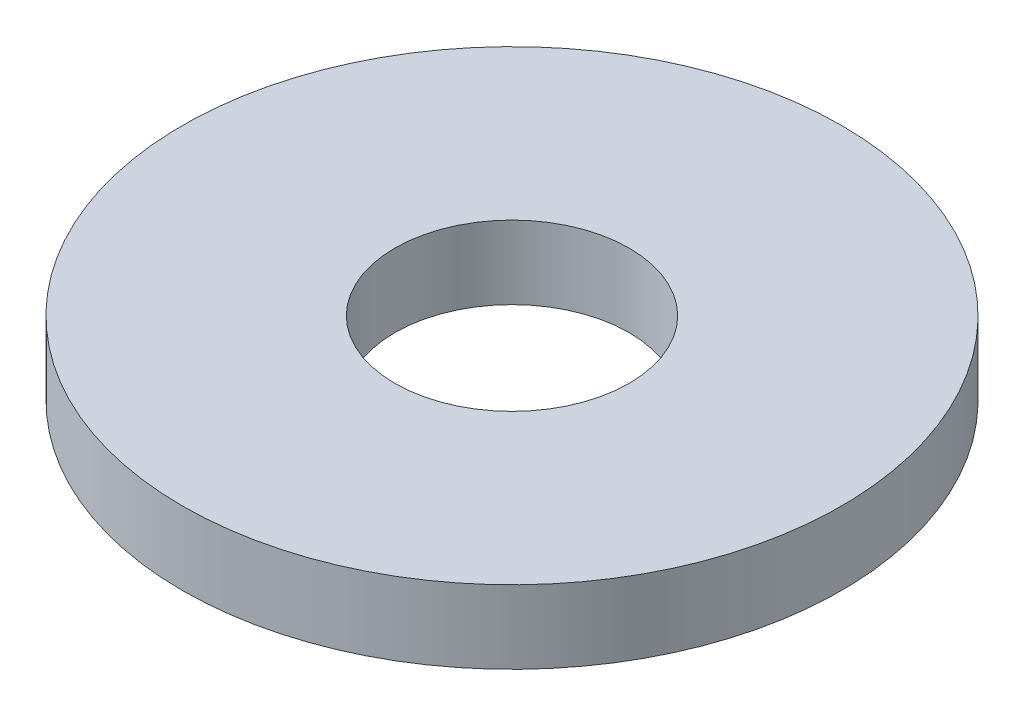
from build123d import *

# Parameters (mm, degrees)
SKETCH1_R           = 4.5
SKETCH1_R_2         = 1.6
BOSS_EXTRUDE1_DEPTH = 1


with BuildPart() as part:
    # Sketch1 → Boss-Extrude1 (new body)
    with BuildSketch(Plane(origin=(0, 0, 0), x_dir=(1, 0, 0), z_dir=(0, 1, 0))):
        with Locations(Location((0, 0, 0), (0, 0, 270))):
            Circle(SKETCH1_R)
        with Locations(Location((0, 0, 0), (0, 0, 270))):
            Circle(SKETCH1_R_2, mode=Mode.SUBTRACT)
    extrude(amount=BOSS_EXTRUDE1_DEPTH)


solid = part.part
